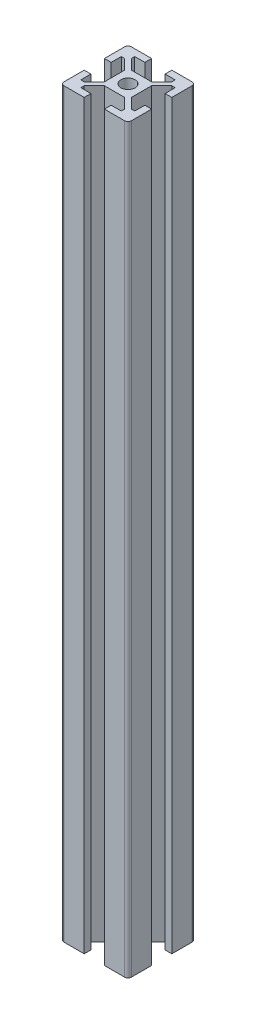
from build123d import *

# Parameters (mm, degrees)
SKETCH1_W           = 8
SKETCH1_H           = 8
SKETCH1_R           = 2.1
BOSS_EXTRUDE1_DEPTH = 220
FILLET1_R           = 1


with BuildPart() as part:
    # Sketch1 → Boss-Extrude1 (new body)
    # profile 1 of 6: a face of its own
    with BuildSketch(Plane(origin=(0, 0, 0), x_dir=(1, 0, 0), z_dir=(0, 1, 0))):
        Polygon((-4, 4), (-10, 10), (-10, 3), (-8, 3), (-8, 6), (-7, 6), (-4, 3), align=None)
    # profile 2 of 6: a face of its own
    with BuildSketch(Plane(origin=(0, 0, 0), x_dir=(1, 0, 0), z_dir=(0, 1, 0))):
        Polygon((-3, 8), (-3, 10), (-10, 10), (-4, 4), (-3, 4), (-6, 7), (-6, 8), align=None)
    # profile 3 of 6: a face of its own
    with BuildSketch(Plane(origin=(0, 0, 0), x_dir=(1, 0, 0), z_dir=(0, 1, 0))):
        Polygon((6, 7), (3, 4), (4, 4), (4, 3), (7, 6), (8, 6), (8, 3), (10, 3), (10, 10), (3, 10), (3, 8), (6, 8), align=None)
    # profile 4 of 6: a face of its own
    with BuildSketch(Plane(origin=(0, 0, 0), x_dir=(1, 0, 0), z_dir=(0, 1, 0))):
        Rectangle(SKETCH1_W, SKETCH1_H)
        with Locations(Location((0, 0, 0), (0, 0, 270))):
            Circle(SKETCH1_R, mode=Mode.SUBTRACT)
    # profile 5 of 6: a face of its own
    with BuildSketch(Plane(origin=(0, 0, 0), x_dir=(1, 0, 0), z_dir=(0, 1, 0))):
        Polygon((4, -4), (3, -4), (6, -7), (6, -8), (3, -8), (3, -10), (10, -10), (10, -3), (8, -3), (8, -6), (7, -6), (4, -3), align=None)
    # profile 6 of 6: a face of its own
    with BuildSketch(Plane(origin=(0, 0, 0), x_dir=(1, 0, 0), z_dir=(0, 1, 0))):
        Polygon((-4, -4), (-4, -3), (-7, -6), (-8, -6), (-8, -3), (-10, -3), (-10, -10), (-3, -10), (-3, -8), (-6, -8), (-6, -7), (-3, -4), align=None)
    extrude(amount=BOSS_EXTRUDE1_DEPTH)

    # Fillet1
    fillet1_edges = [part.edges().sort_by_distance(p)[0] for p in [
        (-10, 110, 10),
        (-10, 110, -10),
        (10, 110, -10),
        (10, 110, 10),
    ]]
    fillet(fillet1_edges, radius=FILLET1_R)


solid = part.part
